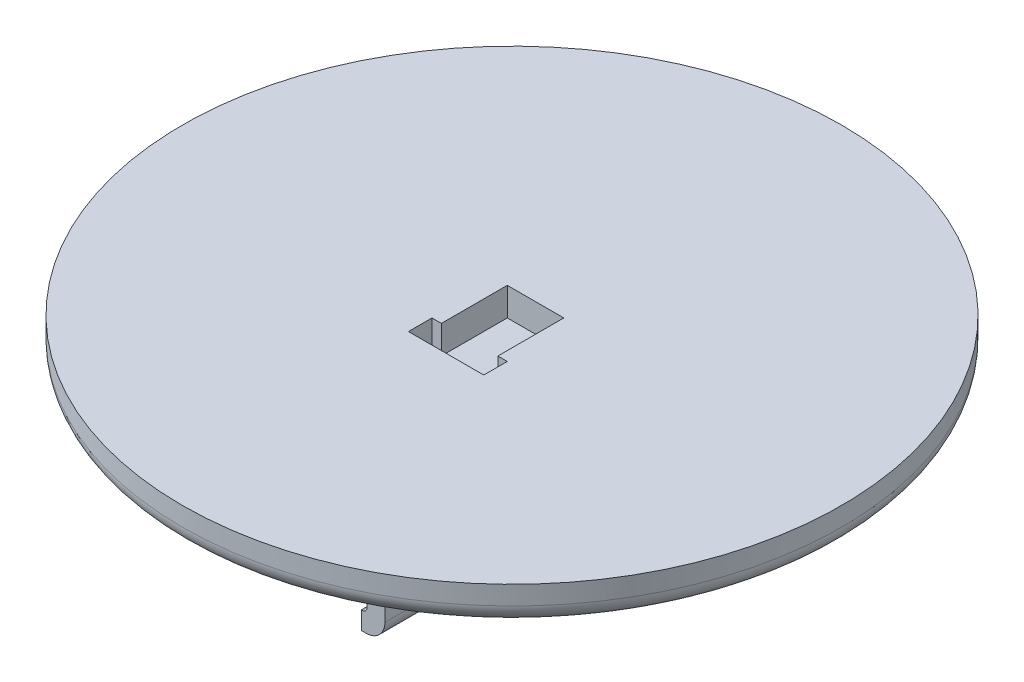
from build123d import *

# Parameters (mm, degrees)
SKETCH1_R                  = 35
ROUND_BODY_DEPTH           = 4
FILLET1_R                  = 2
SKETCH2_W                  = 6
SKETCH2_H                  = 7
SENSOR_SQUARE_HOLE_DEPTH   = 3
SKETCH4_W                  = 8
SKETCH4_H                  = 2.5
SENSOR_LEAD_HOLE_DEPTH     = 4
SKETCH5_W                  = 15
SKETCH5_H                  = 24
BACK_HOLDER_DEPTH          = 12
SKETCH6_W                  = 11.2
SKETCH6_H                  = 10.1
HOLDER_SLOT_DEPTH          = 22
HOLDER_ROUNDS_R            = 2
SKETCH7_W                  = 10
SKETCH7_H                  = 1.9
HOLDER_TOP_REMOVAL_DEPTH   = 22
HOLDER_MICRO_TOP_FILLETS_R = 0.5


with BuildPart() as part:
    # Sketch1 → Round Body (new body)
    with BuildSketch(Plane(origin=(0, 0, 0), x_dir=(1, 0, 0), z_dir=(0, 1, 0))):
        with Locations(Location((0, 0, 0), (0, 0, 270))):
            Circle(SKETCH1_R)
    extrude(amount=ROUND_BODY_DEPTH)

    # Fillet1
    fillet1_edges = [part.edges().sort_by_distance(p)[0] for p in [
        (0, 0, -35),
    ]]
    fillet(fillet1_edges, radius=FILLET1_R)

    # Sketch2 → Sensor Square Hole (cut)
    with BuildSketch(Plane(origin=(0, 4, 0), x_dir=(1, 0, 0), z_dir=(0, 1, 0))):
        with Locations((0, -1)):
            Rectangle(SKETCH2_W, SKETCH2_H)
    extrude(amount=-SENSOR_SQUARE_HOLE_DEPTH, mode=Mode.SUBTRACT)

    # Sketch4 → Sensor Lead Hole (cut)
    with BuildSketch(Plane(origin=(0, 4, 0), x_dir=(1, 0, 0), z_dir=(0, 1, 0))):
        with Locations((0, -5.75)):
            Rectangle(SKETCH4_W, SKETCH4_H)
    extrude(amount=-SENSOR_LEAD_HOLE_DEPTH, mode=Mode.SUBTRACT)

    # Sketch5 → Back Holder (add)
    with BuildSketch(Plane.XZ):
        with Locations((0, 9)):
            Rectangle(SKETCH5_W, SKETCH5_H)
    extrude(amount=BACK_HOLDER_DEPTH)

    # Sketch6 → Holder Slot (cut)
    with BuildSketch(Plane.XY.offset(21)):
        with Locations((0, -5.05)):
            Rectangle(SKETCH6_W, SKETCH6_H)
    extrude(amount=-HOLDER_SLOT_DEPTH, mode=Mode.SUBTRACT)

    # Holder Rounds
    holder_rounds_edges = [part.edges().sort_by_distance(p)[0] for p in [
        (-7.5, 0, 9),
        (0, 0, -3),
        (-7.5, -6, -3),
        (7.5, 0, 9),
        (7.5, -6, -3),
        (-7.5, -12, 9),
        (0, -12, -3),
        (7.5, -12, 9),
    ]]
    fillet(holder_rounds_edges, radius=HOLDER_ROUNDS_R)

    # Sketch7 → Holder Top Removal (cut)
    with BuildSketch(Plane.XY.offset(21)):
        with Locations((0, -11.05)):
            Rectangle(SKETCH7_W, SKETCH7_H)
    extrude(amount=-HOLDER_TOP_REMOVAL_DEPTH, mode=Mode.SUBTRACT)

    # Holder Micro Top fillets
    holder_micro_top_fillets_edges = [part.edges().sort_by_distance(p)[0] for p in [
        (-5.6, -10.1, 10),
        (5.6, -10.1, 10),
    ]]
    fillet(holder_micro_top_fillets_edges, radius=HOLDER_MICRO_TOP_FILLETS_R)


solid = part.part
